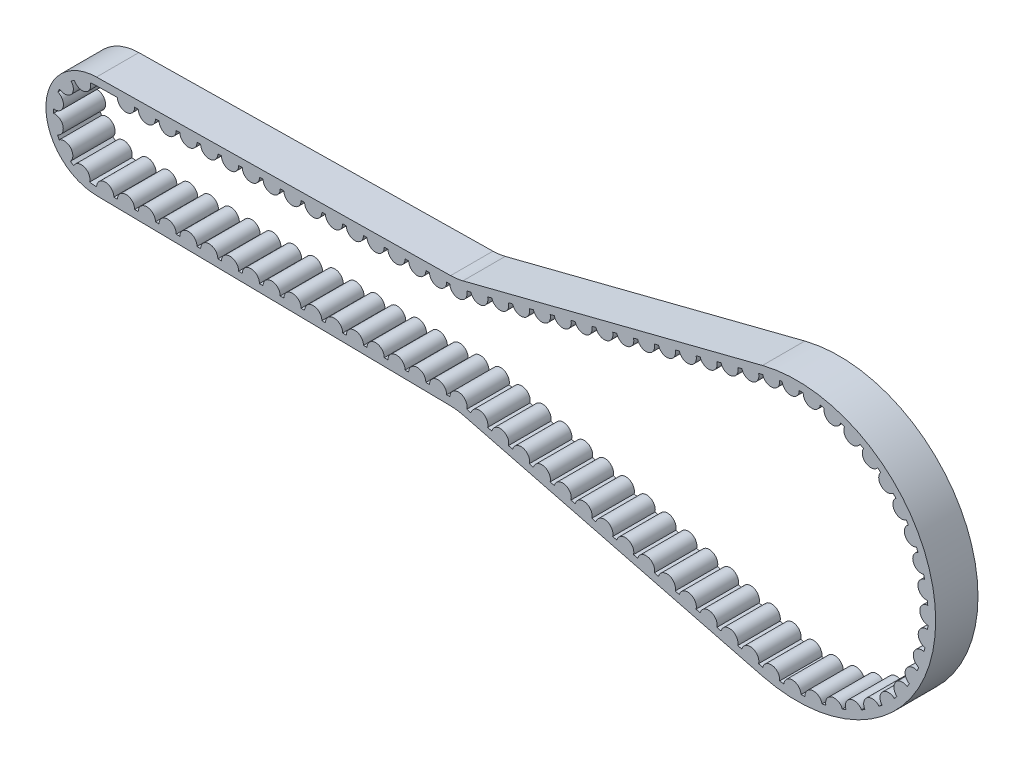
from build123d import *

# Parameters (mm, degrees)
BOSS_EXTRUDE2_DEPTH = 6


with BuildPart() as part:
    # Sketch1<3> → Boss-Extrude2 (new body)
    with BuildSketch(Plane.XY):
        with BuildLine():
            Line((50.107760002, 8.000774188), (-0.104599042, 7.279248522))
            ThreePointArc((-0.104599042, 7.279248522), (-7.28, 0), (-0.104599042, -7.279248522))
            Line((-0.104599042, -7.279248522), (50.107760002, -8.000774188))
            ThreePointArc((50.107760002, -8.000774188), (50.988461971, -8.065422478), (51.855460512, -8.233139172))
            Line((51.855460512, -8.233139172), (94.32879767, -19.07793196))
            ThreePointArc((94.32879767, -19.07793196), (118.89, 0), (94.32879767, 19.07793196))
            Line((94.32879767, 19.07793196), (51.855460512, 8.233139172))
            ThreePointArc((51.855460512, 8.233139172), (50.988461971, 8.065422478), (50.107760002, 8.000774188))
        make_face()
        with BuildLine():
            Line((-0.089153441, 6.204359489), (2.860846559, 6.246749465))
            ThreePointArc((2.860846559, 6.246749465), (4.098249584, 5.04440436), (5.300594689, 6.281807386))
            Line((5.300594689, 6.281807386), (5.810846559, 6.289139441))
            ThreePointArc((5.810846559, 6.289139441), (7.048249584, 5.086794336), (8.250594689, 6.324197362))
            Line((8.250594689, 6.324197362), (8.760846559, 6.331529418))
            ThreePointArc((8.760846559, 6.331529418), (9.998249584, 5.129184313), (11.200594689, 6.366587338))
            Line((11.200594689, 6.366587338), (11.710846559, 6.373919394))
            ThreePointArc((11.710846559, 6.373919394), (12.948249584, 5.171574289), (14.150594689, 6.408977315))
            Line((14.150594689, 6.408977315), (14.660846559, 6.416309371))
            ThreePointArc((14.660846559, 6.416309371), (15.898249584, 5.213964265), (17.100594689, 6.451367291))
            Line((17.100594689, 6.451367291), (17.610846559, 6.458699347))
            ThreePointArc((17.610846559, 6.458699347), (18.848249584, 5.256354242), (20.050594689, 6.493757268))
            Line((20.050594689, 6.493757268), (20.560846559, 6.501089323))
            ThreePointArc((20.560846559, 6.501089323), (21.798249584, 5.298744218), (23.000594689, 6.536147244))
            Line((23.000594689, 6.536147244), (23.510846559, 6.5434793))
            ThreePointArc((23.510846559, 6.5434793), (24.748249584, 5.341134195), (25.950594689, 6.57853722))
            Line((25.950594689, 6.57853722), (26.460846559, 6.585869276))
            ThreePointArc((26.460846559, 6.585869276), (27.698249584, 5.383524171), (28.900594689, 6.620927197))
            Line((28.900594689, 6.620927197), (29.410846559, 6.628259253))
            ThreePointArc((29.410846559, 6.628259253), (30.648249584, 5.425914148), (31.850594689, 6.663317173))
            Line((31.850594689, 6.663317173), (32.360846559, 6.670649229))
            ThreePointArc((32.360846559, 6.670649229), (33.598249584, 5.468304124), (34.800594689, 6.70570715))
            Line((34.800594689, 6.70570715), (35.310846559, 6.713039205))
            ThreePointArc((35.310846559, 6.713039205), (36.548249584, 5.5106941), (37.750594689, 6.748097126))
            Line((37.750594689, 6.748097126), (38.260846559, 6.755429182))
            ThreePointArc((38.260846559, 6.755429182), (39.498249584, 5.553084077), (40.700594689, 6.790487102))
            Line((40.700594689, 6.790487102), (41.210846559, 6.797819158))
            ThreePointArc((41.210846559, 6.797819158), (42.448249584, 5.595474053), (43.650594689, 6.832877079))
            Line((43.650594689, 6.832877079), (44.160846559, 6.840209135))
            ThreePointArc((44.160846559, 6.840209135), (45.398249584, 5.63786403), (46.600594689, 6.875267055))
            Line((46.600594689, 6.875267055), (47.110542045, 6.882594735))
            ThreePointArc((47.110542045, 6.882594735), (48.34794507, 5.68024963), (49.550290176, 6.917652656))
            Line((49.550290176, 6.917652656), (50.000569547, 6.924122938))
            ThreePointArc((50.000569547, 6.924122938), (51.39057355, 5.753380374), (52.402076028, 7.263218781))
            Line((52.402076028, 7.263218781), (52.993114042, 7.41412957))
            ThreePointArc((52.993114042, 7.41412957), (54.477011647, 6.533875118), (55.357266098, 8.017772723))
            Line((55.357266098, 8.017772723), (55.948304112, 8.168683511))
            ThreePointArc((55.948304112, 8.168683511), (57.432201716, 7.28842906), (58.312456168, 8.772326664))
            Line((58.312456168, 8.772326664), (58.903494182, 8.923237452))
            ThreePointArc((58.903494182, 8.923237452), (60.387391786, 8.042983001), (61.267646238, 9.526880606))
            Line((61.267646238, 9.526880606), (61.858684252, 9.677791394))
            ThreePointArc((61.858684252, 9.677791394), (63.342581856, 8.797536942), (64.222836308, 10.281434547))
            Line((64.222836308, 10.281434547), (64.813874322, 10.432345335))
            ThreePointArc((64.813874322, 10.432345335), (66.297771926, 9.552090884), (67.178026378, 11.035988488))
            Line((67.178026378, 11.035988488), (67.769064392, 11.186899277))
            ThreePointArc((67.769064392, 11.186899277), (69.252961996, 10.306644825), (70.133216448, 11.79054243))
            Line((70.133216448, 11.79054243), (70.724254462, 11.941453218))
            ThreePointArc((70.724254462, 11.941453218), (72.208152066, 11.061198766), (73.088406518, 12.545096371))
            Line((73.088406518, 12.545096371), (73.679444532, 12.696007159))
            ThreePointArc((73.679444532, 12.696007159), (75.163342136, 11.815752708), (76.043596588, 13.299650312))
            Line((76.043596588, 13.299650312), (76.634634602, 13.450561101))
            ThreePointArc((76.634634602, 13.450561101), (78.118532206, 12.570306649), (78.998786658, 14.054204254))
            Line((78.998786658, 14.054204254), (79.589824672, 14.205115042))
            ThreePointArc((79.589824672, 14.205115042), (81.073722276, 13.324860591), (81.953976728, 14.808758195))
            Line((81.953976728, 14.808758195), (82.545014742, 14.959668983))
            ThreePointArc((82.545014742, 14.959668983), (84.028912346, 14.079414532), (84.909166797, 15.563312137))
            Line((84.909166797, 15.563312137), (85.500204811, 15.714222925))
            ThreePointArc((85.500204811, 15.714222925), (86.984102416, 14.833968473), (87.864356867, 16.317866078))
            Line((87.864356867, 16.317866078), (88.455394881, 16.468776866))
            ThreePointArc((88.455394881, 16.468776866), (89.939292486, 15.588522415), (90.819546937, 17.072420019))
            Line((90.819546937, 17.072420019), (91.410584951, 17.223330808))
            ThreePointArc((91.410584951, 17.223330808), (92.235535432, 16.358592766), (93.403194754, 16.613321807))
            ThreePointArc((93.403194754, 16.613321807), (93.759220598, 17.168026837), (93.774737007, 17.826973961))
            Line((93.774737007, 17.826973961), (94.365775021, 17.977884749))
            ThreePointArc((94.365775021, 17.977884749), (95.786138529, 17.083203473), (96.755368463, 18.453780145))
            ThreePointArc((96.755368463, 18.453780145), (96.934070173, 18.476574006), (97.112984102, 18.497637407))
            ThreePointArc((97.112984102, 18.497637407), (98.382496673, 17.41575925), (99.545082682, 18.611801174))
            ThreePointArc((99.545082682, 18.611801174), (99.826232875, 18.604463373), (100.107240119, 18.592878754))
            ThreePointArc((100.107240119, 18.592878754), (101.186767375, 17.321366498), (102.526156818, 18.315428082))
            ThreePointArc((102.526156818, 18.315428082), (102.802489123, 18.263085641), (103.077999094, 18.206574308))
            ThreePointArc((103.077999094, 18.206574308), (103.939581845, 16.778359452), (105.421085238, 17.544695023))
            ThreePointArc((105.421085238, 17.544695023), (105.685442795, 17.448703584), (105.948319929, 17.348729151))
            ThreePointArc((105.948319929, 17.348729151), (106.569643635, 15.800801709), (108.154890819, 16.319563579))
            ThreePointArc((108.154890819, 16.319563579), (108.400426906, 16.182409269), (108.643862822, 16.041561021))
            ThreePointArc((108.643862822, 16.041561021), (109.008835526, 14.414011502), (110.656769432, 14.671764011))
            ThreePointArc((110.656769432, 14.671764011), (110.877124792, 14.496999055), (111.094814629, 14.318924887))
            ThreePointArc((111.094814629, 14.318924887), (111.19398373, 12.653905968), (112.861923734, 12.643973461))
            ThreePointArc((112.861923734, 12.643973461), (113.05139128, 12.43612418), (113.237696986, 12.225436121))
            ThreePointArc((113.237696986, 12.225436121), (113.068494055, 10.566070916), (114.713241388, 10.28871064))
            ThreePointArc((114.713241388, 10.28871064), (114.866914009, 10.053160221), (115.017010364, 9.81531498))
            ThreePointArc((115.017010364, 9.81531498), (114.583817668, 8.204580178), (116.162774239, 7.666975618))
            ThreePointArc((116.162774239, 7.666975618), (116.276671895, 7.409824693), (116.386671482, 7.150982337))
            ThreePointArc((116.386671482, 7.150982337), (115.700708485, 5.630595123), (117.172980146, 4.846669955))
            ThreePointArc((117.172980146, 4.846669955), (117.244152949, 4.574578598), (117.311206836, 4.301443008))
            ThreePointArc((117.311206836, 4.301443008), (116.39023962, 2.910780612), (117.717695309, 1.900838086))
            ThreePointArc((117.717695309, 1.900838086), (117.74429992, 1.62085332), (117.766671446, 1.340498564))
            ThreePointArc((117.766671446, 1.340498564), (116.634552578, 0.115578412), (117.782811891, -1.094224491))
            ThreePointArc((117.782811891, -1.094224491), (117.764159263, -1.374851207), (117.741269019, -1.655164088))
            ThreePointArc((117.741269019, -1.655164088), (116.427319782, -2.682617209), (117.366643405, -4.060947229))
            ThreePointArc((117.366643405, -4.060947229), (117.303216633, -4.334947811), (117.235657464, -4.60795886))
            ThreePointArc((117.235657464, -4.60795886), (115.773908453, -5.411334452), (116.479968398, -6.922493566))
            ThreePointArc((116.479968398, -6.922493566), (116.373410202, -7.182771543), (116.262931853, -7.441409918))
            ThreePointArc((116.262931853, -7.441409918), (114.691241601, -7.999900976), (115.145751286, -9.604750956))
            ThreePointArc((115.145751286, -9.604750956), (114.998821467, -9.844565265), (114.848285271, -10.082132368))
            ThreePointArc((114.848285271, -10.082132368), (113.207359728, -10.381274267), (113.398547591, -12.038250342))
            ThreePointArc((113.398547591, -12.038250342), (113.215051555, -12.251389918), (113.02835632, -12.461732885))
            ThreePointArc((113.02835632, -12.461732885), (111.360694596, -12.493778007), (111.283608973, -14.159965367))
            ThreePointArc((111.283608973, -14.159965367), (111.068299169, -14.340910007), (110.850280203, -14.518581066))
            ThreePointArc((110.850280203, -14.518581066), (109.199073862, -14.282699459), (108.855711228, -15.914944727))
            ThreePointArc((108.855711228, -15.914944727), (108.614164069, -16.059008061), (108.370467949, -16.199405625))
            ThreePointArc((108.370467949, -16.199405625), (106.778482368, -15.701706498), (106.177735636, -17.257735379))
            ThreePointArc((106.177735636, -17.257735379), (105.916207064, -17.36118624), (105.653145393, -17.460674086))
            ThreePointArc((105.653145393, -17.460674086), (104.16161216, -16.714047587), (103.319040355, -18.153559749))
            ThreePointArc((103.319040355, -18.153559749), (103.044303825, -18.213718816), (102.76868976, -18.269720261))
            ThreePointArc((102.76868976, -18.269720261), (101.416238804, -17.293503622), (100.353664093, -18.579216457))
            ThreePointArc((100.353664093, -18.579216457), (100.072835135, -18.594525641), (99.791806937, -18.605590277))
            ThreePointArc((99.791806937, -18.605590277), (98.613466027, -17.425066997), (97.358408536, -18.523681218))
            ThreePointArc((97.358408536, -18.523681218), (97.056603527, -18.49118916), (96.755368463, -18.453780145))
            ThreePointArc((96.755368463, -18.453780145), (96.642518646, -17.741094357), (96.146743958, -17.216820027))
            ThreePointArc((96.146743958, -17.216820027), (95.068444629, -17.157846493), (94.365775021, -17.977884749))
            Line((94.365775021, -17.977884749), (93.774737007, -17.826973961))
            ThreePointArc((93.774737007, -17.826973961), (93.433651059, -16.641333576), (92.232543282, -16.35951297))
            ThreePointArc((92.232543282, -16.35951297), (91.708842171, -16.684162304), (91.410584951, -17.223330808))
            Line((91.410584951, -17.223330808), (90.819546937, -17.072420019))
            ThreePointArc((90.819546937, -17.072420019), (89.939292486, -15.588522415), (88.455394881, -16.468776866))
            Line((88.455394881, -16.468776866), (87.864356867, -16.317866078))
            ThreePointArc((87.864356867, -16.317866078), (86.984102416, -14.833968473), (85.500204811, -15.714222925))
            Line((85.500204811, -15.714222925), (84.909166797, -15.563312137))
            ThreePointArc((84.909166797, -15.563312137), (84.028912346, -14.079414532), (82.545014742, -14.959668983))
            Line((82.545014742, -14.959668983), (81.953976728, -14.808758195))
            ThreePointArc((81.953976728, -14.808758195), (81.073722276, -13.324860591), (79.589824672, -14.205115042))
            Line((79.589824672, -14.205115042), (78.998786658, -14.054204254))
            ThreePointArc((78.998786658, -14.054204254), (78.118532206, -12.570306649), (76.634634602, -13.450561101))
            Line((76.634634602, -13.450561101), (76.043596588, -13.299650312))
            ThreePointArc((76.043596588, -13.299650312), (75.163342136, -11.815752708), (73.679444532, -12.696007159))
            Line((73.679444532, -12.696007159), (73.088406518, -12.545096371))
            ThreePointArc((73.088406518, -12.545096371), (72.208152066, -11.061198766), (70.724254462, -11.941453218))
            Line((70.724254462, -11.941453218), (70.133216448, -11.79054243))
            ThreePointArc((70.133216448, -11.79054243), (69.252961996, -10.306644825), (67.769064392, -11.186899277))
            Line((67.769064392, -11.186899277), (67.178026378, -11.035988488))
            ThreePointArc((67.178026378, -11.035988488), (66.297771926, -9.552090884), (64.813874322, -10.432345335))
            Line((64.813874322, -10.432345335), (64.222836308, -10.281434547))
            ThreePointArc((64.222836308, -10.281434547), (63.342581856, -8.797536942), (61.858684252, -9.677791394))
            Line((61.858684252, -9.677791394), (61.267646238, -9.526880606))
            ThreePointArc((61.267646238, -9.526880606), (60.387391786, -8.042983001), (58.903494182, -8.923237452))
            Line((58.903494182, -8.923237452), (58.312456168, -8.772326664))
            ThreePointArc((58.312456168, -8.772326664), (57.432201716, -7.28842906), (55.948304112, -8.168683511))
            Line((55.948304112, -8.168683511), (55.357266098, -8.017772723))
            ThreePointArc((55.357266098, -8.017772723), (54.477011647, -6.533875118), (52.993114042, -7.41412957))
            Line((52.993114042, -7.41412957), (52.402076028, -7.263218781))
            ThreePointArc((52.402076028, -7.263218781), (51.39057355, -5.753380374), (50.000569547, -6.924122938))
            Line((50.000569547, -6.924122938), (49.545722467, -6.91758702))
            ThreePointArc((49.545722467, -6.91758702), (48.343377362, -5.680183995), (47.105974336, -6.8825291))
            Line((47.105974336, -6.8825291), (46.596026981, -6.87520142))
            ThreePointArc((46.596026981, -6.87520142), (45.393681876, -5.637798394), (44.15627885, -6.840143499))
            Line((44.15627885, -6.840143499), (43.646331495, -6.832815819))
            ThreePointArc((43.646331495, -6.832815819), (42.44398639, -5.595412793), (41.206583364, -6.797757898))
            Line((41.206583364, -6.797757898), (40.696636009, -6.790430218))
            ThreePointArc((40.696636009, -6.790430218), (39.494290904, -5.553027193), (38.256887878, -6.755372298))
            Line((38.256887878, -6.755372298), (37.746940523, -6.748044618))
            ThreePointArc((37.746940523, -6.748044618), (36.544595418, -5.510641592), (35.307192392, -6.712986697))
            Line((35.307192392, -6.712986697), (34.797245037, -6.705659017))
            ThreePointArc((34.797245037, -6.705659017), (33.594899932, -5.468255991), (32.357496906, -6.670601096))
            Line((32.357496906, -6.670601096), (31.847549551, -6.663273416))
            ThreePointArc((31.847549551, -6.663273416), (30.645204445, -5.42587039), (29.40780142, -6.628215496))
            Line((29.40780142, -6.628215496), (28.897854065, -6.620887815))
            ThreePointArc((28.897854065, -6.620887815), (27.695508959, -5.38348479), (26.458105934, -6.585829895))
            Line((26.458105934, -6.585829895), (25.948158578, -6.578502215))
            ThreePointArc((25.948158578, -6.578502215), (24.745813473, -5.341099189), (23.508410448, -6.543444294))
            Line((23.508410448, -6.543444294), (22.998463092, -6.536116614))
            ThreePointArc((22.998463092, -6.536116614), (21.796117987, -5.298713588), (20.558714961, -6.501058693))
            Line((20.558714961, -6.501058693), (20.048767606, -6.493731013))
            ThreePointArc((20.048767606, -6.493731013), (18.846422501, -5.256327988), (17.609019475, -6.458673093))
            Line((17.609019475, -6.458673093), (17.09907212, -6.451345413))
            ThreePointArc((17.09907212, -6.451345413), (15.896727015, -5.213942387), (14.659323989, -6.416287492))
            Line((14.659323989, -6.416287492), (14.149376634, -6.408959812))
            ThreePointArc((14.149376634, -6.408959812), (12.947031529, -5.171556786), (11.709628503, -6.373901891))
            Line((11.709628503, -6.373901891), (11.199681148, -6.366574211))
            ThreePointArc((11.199681148, -6.366574211), (9.997336043, -5.129171186), (8.759933017, -6.331516291))
            Line((8.759933017, -6.331516291), (8.249985662, -6.324188611))
            ThreePointArc((8.249985662, -6.324188611), (7.047640557, -5.086785585), (5.810237531, -6.28913069))
            Line((5.810237531, -6.28913069), (5.300290176, -6.28180301))
            ThreePointArc((5.300290176, -6.28180301), (4.09794507, -5.044399984), (2.860542045, -6.246745089))
            Line((2.860542045, -6.246745089), (2.350594689, -6.239417409))
            ThreePointArc((2.350594689, -6.239417409), (1.97403576, -5.34028787), (1.059084054, -5.003993461))
            ThreePointArc((1.059084054, -5.003993461), (0.249120045, -5.378573312), (-0.089153441, -6.204359489))
            ThreePointArc((-0.089153441, -6.204359489), (-0.586865522, -6.177184946), (-1.080790527, -6.110148676))
            ThreePointArc((-1.080790527, -6.110148676), (-1.811978453, -4.644024019), (-3.34288277, -5.227538597))
            ThreePointArc((-3.34288277, -5.227538597), (-3.573275086, -5.072842414), (-3.796520158, -4.907999561))
            ThreePointArc((-3.796520158, -4.907999561), (-3.762612812, -3.270010677), (-5.389334011, -3.075240466))
            ThreePointArc((-5.389334011, -3.075240466), (-5.521445374, -2.83119515), (-5.642512775, -2.581486894))
            ThreePointArc((-5.642512775, -2.581486894), (-4.851277921, -1.146877296), (-6.201153778, -0.218441804))
            ThreePointArc((-6.201153778, -0.218441804), (-6.204719068, 0.059044803), (-6.195873714, 0.33641331))
            ThreePointArc((-6.195873714, 0.33641331), (-4.828573722, 1.238991851), (-5.592363947, 2.688399243))
            ThreePointArc((-5.592363947, 2.688399243), (-5.466566398, 2.935758304), (-5.329834654, 3.177245278))
            ThreePointArc((-5.329834654, 3.177245278), (-3.699701474, 3.341022897), (-3.702430931, 4.979360421))
            ThreePointArc((-3.702430931, 4.979360421), (-3.476089245, 5.139924957), (-3.242794706, 5.290208644))
            ThreePointArc((-3.242794706, 5.290208644), (-1.723272205, 4.677665861), (-0.964315607, 6.129610135))
            ThreePointArc((-0.964315607, 6.129610135), (-0.528058828, 6.182489699), (-0.089153441, 6.204359489))
        make_face(mode=Mode.SUBTRACT)
    extrude(amount=BOSS_EXTRUDE2_DEPTH)


solid = part.part
